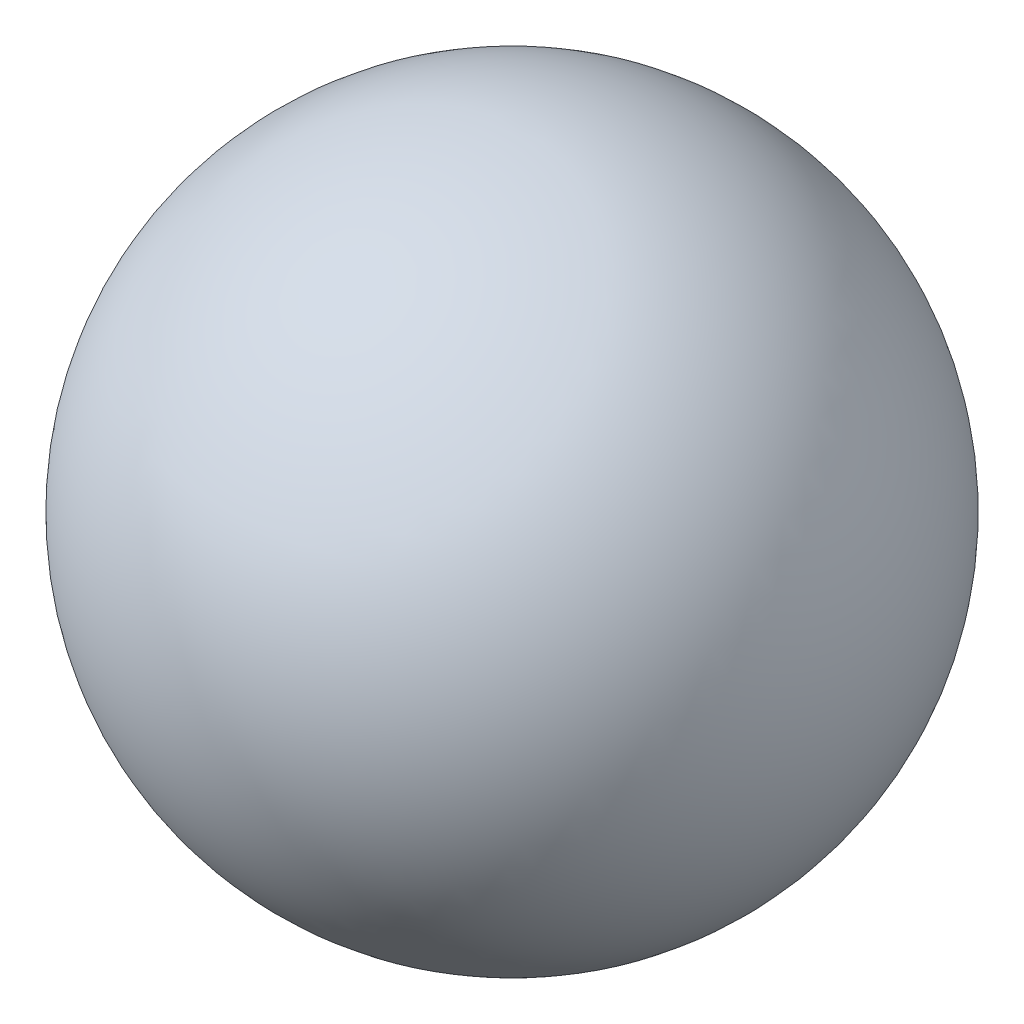
from build123d import *


with BuildPart() as part:
    # Sketch1 → Revolve1 (revolve)
    with BuildSketch(Plane.XY):
        with BuildLine():
            Line((0, 7.493), (0, -7.493))
            ThreePointArc((0, -7.493), (7.493, 0), (0, 7.493))
        make_face()
    revolve(axis=Axis((0, 7.493, 0), (0, -1, 0)))


solid = part.part
